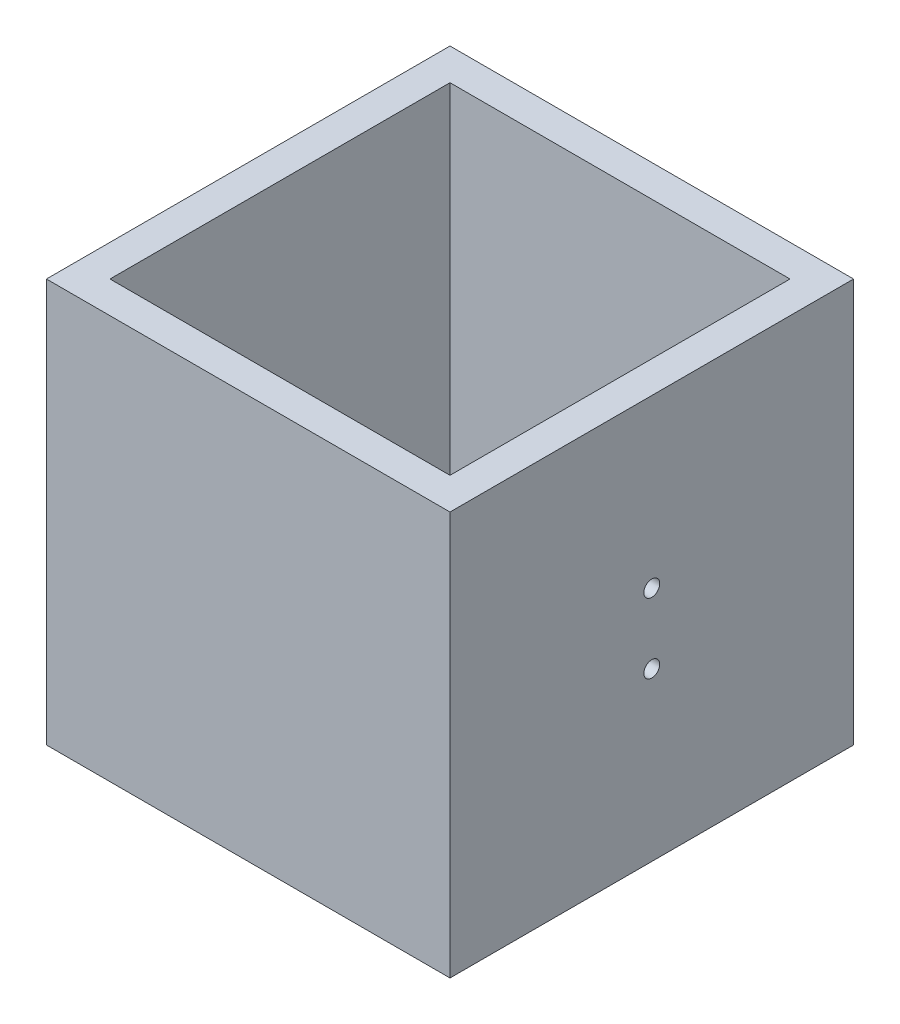
from build123d import *

# Parameters (mm, degrees)
SKETCH1_W           = 25.4
SKETCH1_H           = 25.4
BOSS_EXTRUDE1_DEPTH = 25.4
SHELL1_T            = -2
SKETCH2_R           = 0.5
CUT_EXTRUDE1_DEPTH  = 6.4
SKETCH3_R           = 0.5
CUT_EXTRUDE2_DEPTH  = 6.4
SKETCH5_W           = 24
SKETCH5_H           = 24
CUT_EXTRUDE3_DEPTH  = 1.5


with BuildPart() as part:
    # Sketch1 → Boss-Extrude1 (new body)
    with BuildSketch(Plane(origin=(0, 0, 0), x_dir=(1, 0, 0), z_dir=(0, 1, 0))):
        Rectangle(SKETCH1_W, SKETCH1_H)
    extrude(amount=BOSS_EXTRUDE1_DEPTH)

    # Shell1
    shell1_openings = [part.faces().sort_by_distance(p)[0] for p in [
        (0, 25.4, 0),
    ]]
    offset(amount=SHELL1_T, openings=shell1_openings, kind=Kind.INTERSECTION)

    # Sketch2 → Cut-Extrude1 (cut)
    with BuildSketch(Plane(origin=(12.7, 0, 0), x_dir=(0, 0, -1), z_dir=(1, 0, 0))):
        with Locations((0, 10.5)):
            Circle(SKETCH2_R)
    extrude(amount=-CUT_EXTRUDE1_DEPTH, mode=Mode.SUBTRACT)

    # Sketch3 → Cut-Extrude2 (cut)
    with BuildSketch(Plane(origin=(12.7, 0, 0), x_dir=(0, 0, -1), z_dir=(1, 0, 0))):
        with Locations((0, 14.9)):
            Circle(SKETCH3_R)
    extrude(amount=-CUT_EXTRUDE2_DEPTH, mode=Mode.SUBTRACT)

    # Sketch5 → Cut-Extrude3 (cut)
    with BuildSketch(Plane.ZY.offset(12.7)):
        with Locations((0, 12.7)):
            Rectangle(SKETCH5_W, SKETCH5_H)
    extrude(amount=-CUT_EXTRUDE3_DEPTH, mode=Mode.SUBTRACT)


solid = part.part
